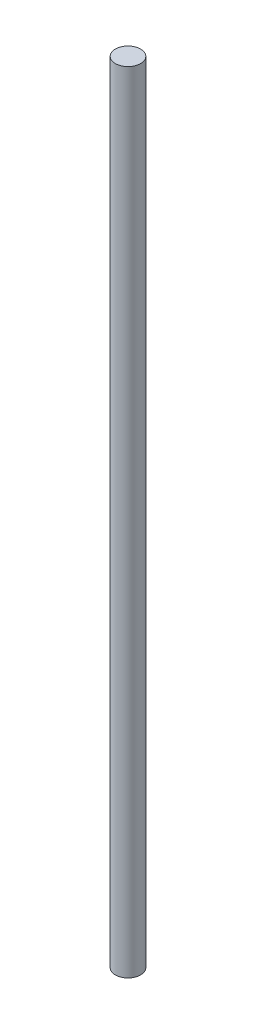
from build123d import *

# Parameters (mm, degrees)
SKETCH1_R           = 0.575
BOSS_EXTRUDE1_DEPTH = 36


with BuildPart() as part:
    # Sketch1 → Boss-Extrude1 (new body)
    with BuildSketch(Plane(origin=(0, 0, 0), x_dir=(1, 0, 0), z_dir=(0, 1, 0))):
        with Locations(Location((0, 0, 0), (0, 0, 270))):
            Circle(SKETCH1_R)
    extrude(amount=BOSS_EXTRUDE1_DEPTH)


solid = part.part
